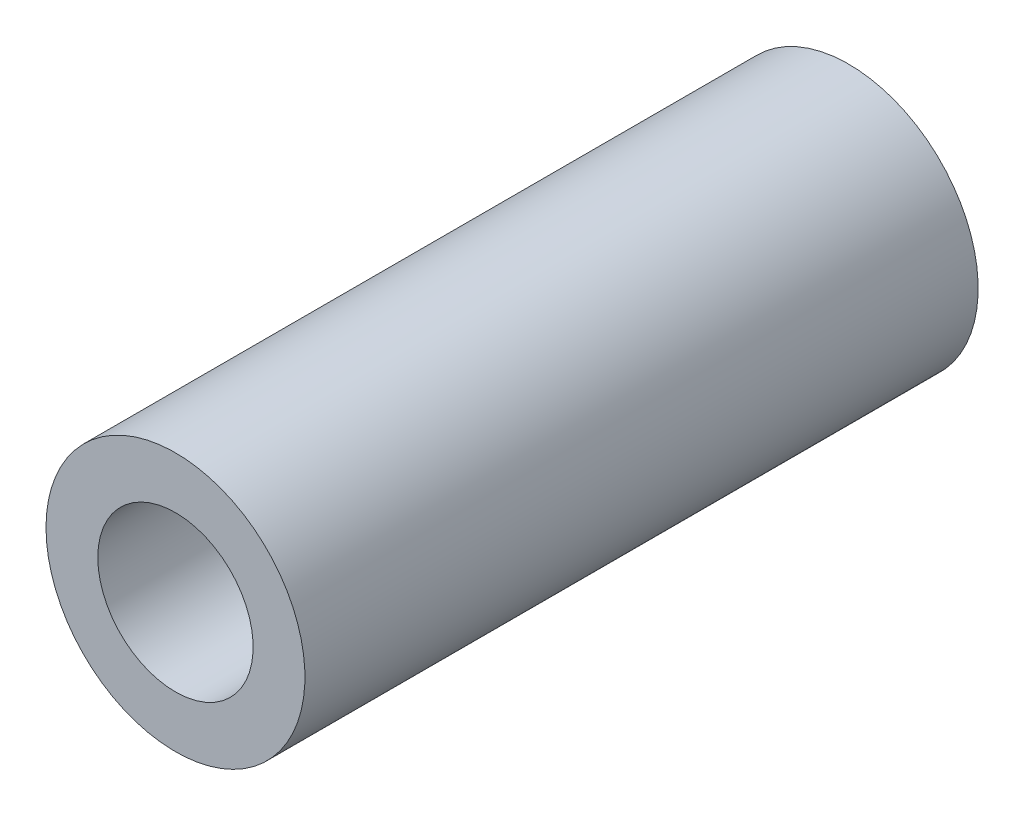
from build123d import *

# Parameters (mm, degrees)
SKETCH_1_R      = 2.5
SKETCH_1_R_2    = 1.5
EXTRUDE_1_DEPTH = 6.5


with BuildPart() as part:
    # 草图1 → 凸台-拉伸1 (new, symmetric)
    with BuildSketch(Plane.XY):
        with Locations(Location((0, 0, 0), (0, 0, 180))):
            Circle(SKETCH_1_R)
        with Locations(Location((0, 0, 0), (0, 0, 180))):
            Circle(SKETCH_1_R_2, mode=Mode.SUBTRACT)
    extrude(amount=EXTRUDE_1_DEPTH, both=True)


solid = part.part
